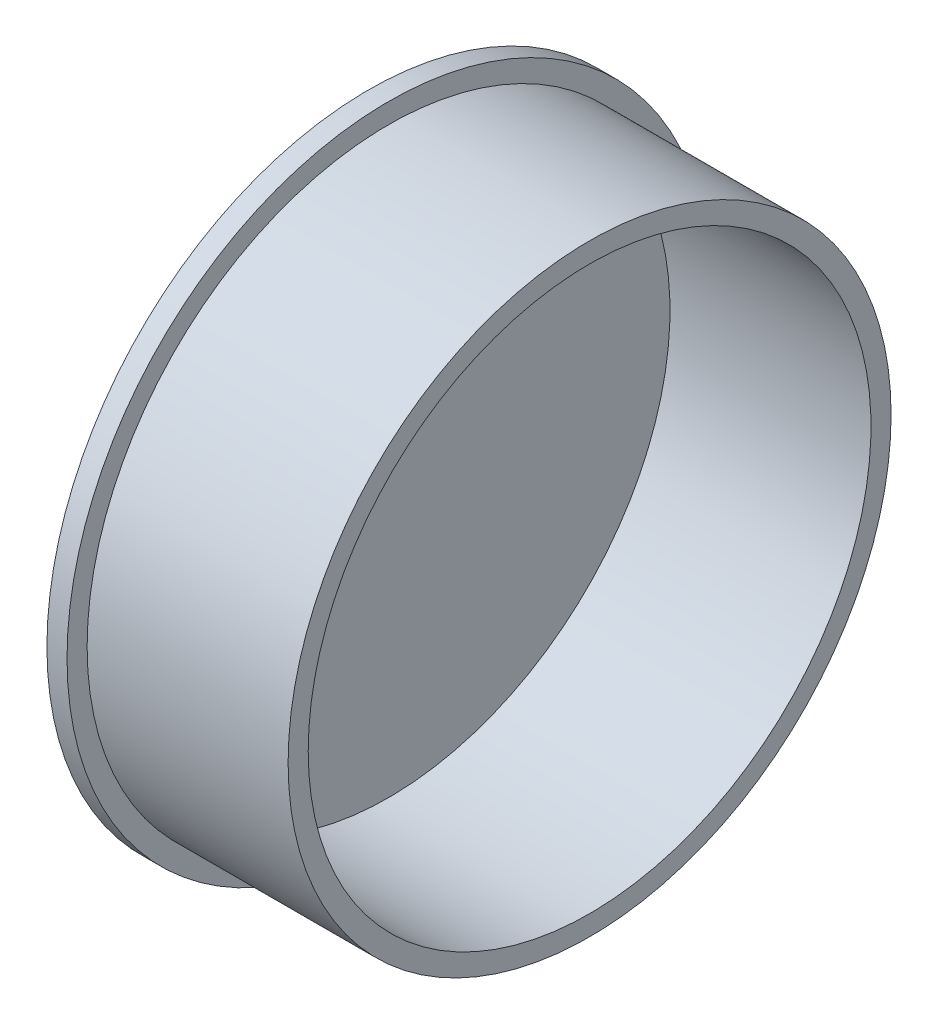
from build123d import *

# Parameters (mm, degrees)
SKIZZE1_W   = 5
SKIZZE1_H   = 80
SKIZZE1_W_2 = 50
SKIZZE1_H_2 = 5


with BuildPart() as part:
    # Skizze1 → Rotation1 (revolve)
    with BuildSketch(Plane.XY, mode=Mode.PRIVATE) as rotation1_sk:
        with Locations((-2.5, 40)):
            Rectangle(SKIZZE1_W, SKIZZE1_H)
        with Locations((25, 72.5)):
            Rectangle(SKIZZE1_W_2, SKIZZE1_H_2)
    revolve(rotation1_sk.sketch.rotate(Axis((0, 0, 0), (1, 0, 0)), 90), axis=Axis((0, 0, 0), (1, 0, 0)))


solid = part.part
